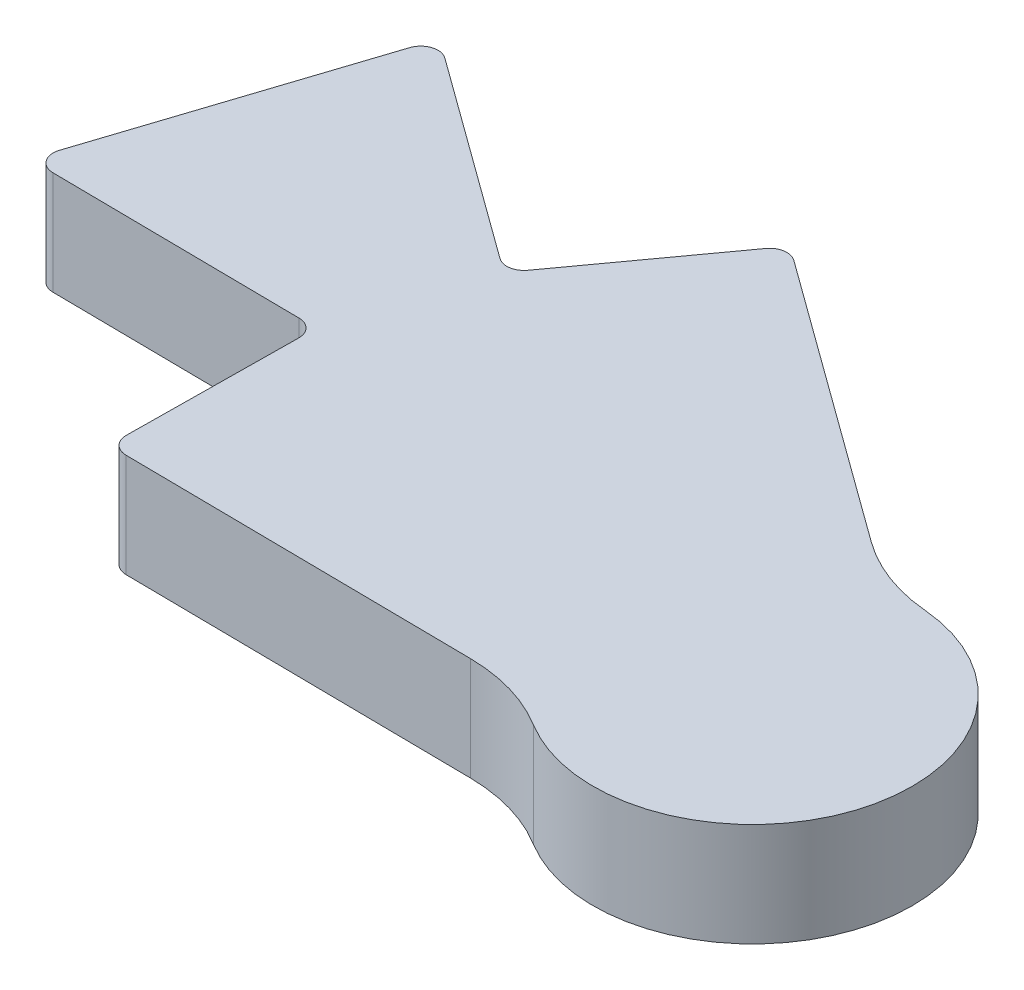
from build123d import *

# Parameters (mm, degrees)
BOSS_EXTRUDE1_DEPTH = 9.525


with BuildPart() as part:
    # Sketch1 → Boss-Extrude1 (new body)
    with BuildSketch(Plane(origin=(0, 0, 0), x_dir=(1, 0, 0), z_dir=(0, 1, 0))):
        with BuildLine():
            Line((-46.373035196, 23.110309708), (-64.906111076, 36.564296932))
            ThreePointArc((-64.906111076, 36.564296932), (-66.328511848, 36.789669498), (-67.347825731, 35.772312158))
            Line((-67.347825731, 35.772312158), (-75.28680268, 11.455483186))
            ThreePointArc((-75.28680268, 11.455483186), (-75.067914414, 10.037862192), (-73.795636305, 9.375389727))
            Line((-73.795636305, 9.375389727), (-50.87703604, 9.116346342))
            ThreePointArc((-50.87703604, 9.116346342), (-49.759830806, 8.638721158), (-49.307579416, 7.511005754))
            Line((-49.307579416, 7.511005754), (-49.484846196, -8.172492476))
            ThreePointArc((-49.484846196, -8.172492476), (-49.032594805, -9.30020788), (-47.915389571, -9.777833064))
            Line((-47.915389571, -9.777833064), (-15.849937724, -10.140261096))
            ThreePointArc((-15.849937724, -10.140261096), (-11.615281586, -10.76526167), (-7.701553332, -12.498948344))
            ThreePointArc((-7.701553332, -12.498948344), (13.937693435, -4.612844582), (1.275661223, 14.625673382))
            ThreePointArc((1.275661223, 14.625673382), (-2.899601677, 15.569134056), (-6.671010295, 17.593835357))
            Line((-6.671010295, 17.593835357), (-32.724313124, 36.507091078))
            ThreePointArc((-32.724313124, 36.507091078), (-33.90587286, 36.790269364), (-34.941599049, 36.155017749))
            Line((-34.941599049, 36.155017749), (-44.155749271, 23.462383037))
            ThreePointArc((-44.155749271, 23.462383037), (-45.19147546, 22.827131422), (-46.373035196, 23.110309708))
        make_face()
    extrude(amount=-BOSS_EXTRUDE1_DEPTH)


solid = part.part
